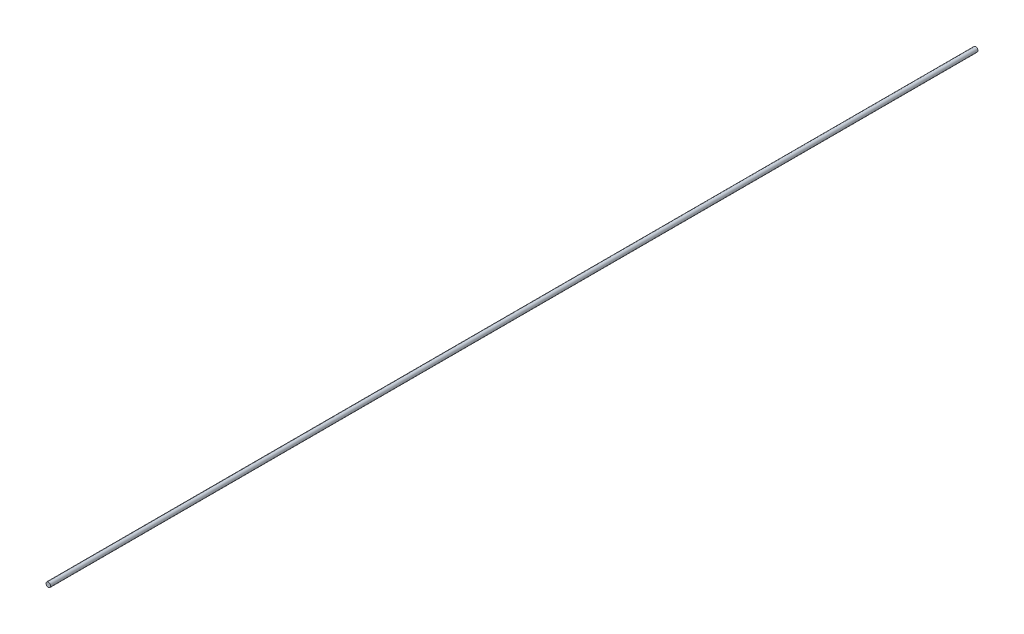
from build123d import *

# Parameters (mm, degrees)
SKETCH1_R           = 1
BOSS_EXTRUDE1_DEPTH = 400


with BuildPart() as part:
    # Sketch1 → Boss-Extrude1 (new body)
    with BuildSketch(Plane.XY):
        Circle(SKETCH1_R)
    extrude(amount=BOSS_EXTRUDE1_DEPTH)


solid = part.part
